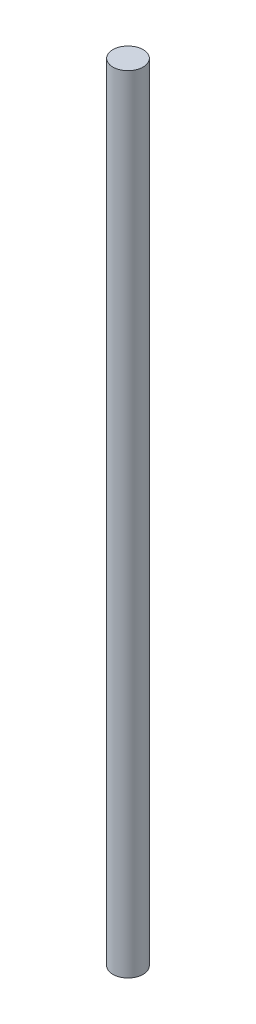
from build123d import *

# Parameters (mm, degrees)
SKETCH1_R           = 1.5
BOSS_EXTRUDE1_DEPTH = 78


with BuildPart() as part:
    # Sketch1 → Boss-Extrude1 (new body)
    with BuildSketch(Plane(origin=(0, 0, 0), x_dir=(1, 0, 0), z_dir=(0, 1, 0))):
        with Locations(Location((0, 0, 0), (0, 0, 270))):
            Circle(SKETCH1_R)
    extrude(amount=BOSS_EXTRUDE1_DEPTH)


solid = part.part
